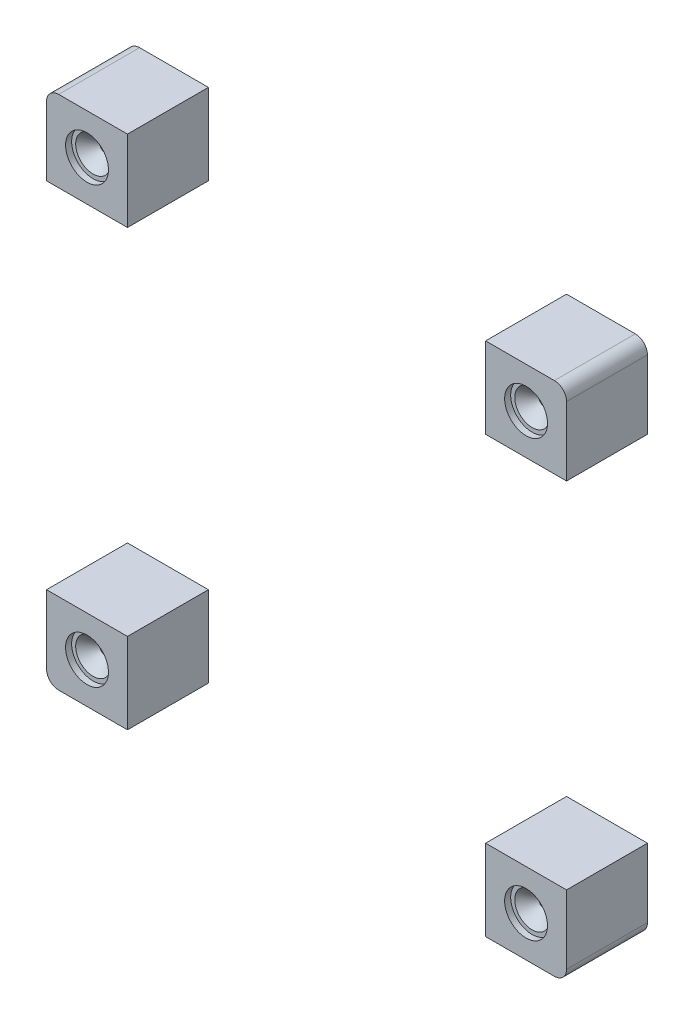
from build123d import *

# Parameters (mm, degrees)
EXTRUDE_1_DEPTH     = 20
EXTRUDE_1_2_DEPTH   = 20
EXTRUDE_1_3_DEPTH   = 20
EXTRUDE_1_4_DEPTH   = 20
SKETCH_2_R          = 1.3
CUT_EXTRUDE_1_DEPTH = 21
SKETCH_3_R          = 5.3
CUT_EXTRUDE_2_DEPTH = 1.5
CHAMFER_1_SIZE      = 3
CHAMFER_2_SIZE      = 3
CHAMFER_3_SIZE      = 3
CHAMFER_4_SIZE      = 3


with BuildPart() as part:
    # Эскиз1 → Бобышка-Вытянуть1 (new body)
    with BuildSketch(Plane.XY):
        with BuildLine():
            Line((-44.25, -43.75), (-64.25, -43.75))
            Line((-64.25, -43.75), (-64.25, -60.75))
            ThreePointArc((-64.25, -60.75), (-63.371320344, -62.871320344), (-61.25, -63.75))
            Line((-61.25, -63.75), (-44.25, -63.75))
            Line((-44.25, -63.75), (-44.25, -43.75))
        make_face()
    extrude(amount=EXTRUDE_1_DEPTH)


with BuildPart() as body_2:
    # Эскиз1 → Extrude 1 2 (new body)
    with BuildSketch(Plane.XY):
        with BuildLine():
            Line((44.25, -43.75), (44.25, -63.75))
            Line((44.25, -63.75), (61.25, -63.75))
            ThreePointArc((61.25, -63.75), (63.371320344, -62.871320344), (64.25, -60.75))
            Line((64.25, -60.75), (64.25, -43.75))
            Line((64.25, -43.75), (44.25, -43.75))
        make_face()
    extrude(amount=EXTRUDE_1_2_DEPTH)


with BuildPart() as body_3:
    # Эскиз1 → Extrude 1 3 (new body)
    with BuildSketch(Plane.XY):
        with BuildLine():
            Line((44.25, 43.75), (44.25, 63.75))
            Line((44.25, 63.75), (61.25, 63.75))
            ThreePointArc((61.25, 63.75), (63.371320344, 62.871320344), (64.25, 60.75))
            Line((64.25, 60.75), (64.25, 43.75))
            Line((64.25, 43.75), (44.25, 43.75))
        make_face()
    extrude(amount=EXTRUDE_1_3_DEPTH)


with BuildPart() as body_4:
    # Эскиз1 → Extrude 1 4 (new body)
    with BuildSketch(Plane.XY):
        with BuildLine():
            Line((-64.25, 60.75), (-64.25, 43.75))
            Line((-64.25, 43.75), (-44.25, 43.75))
            Line((-44.25, 43.75), (-44.25, 63.75))
            Line((-44.25, 63.75), (-61.25, 63.75))
            ThreePointArc((-61.25, 63.75), (-63.371320344, 62.871320344), (-64.25, 60.75))
        make_face()
    extrude(amount=EXTRUDE_1_4_DEPTH)


with BuildPart() as cut_extrude_1_tool:
    # Эскиз2 → Вырез-Вытянуть1 (new body)
    with BuildSketch(Plane.XY.offset(20)):
        with Locations((54.25, 53.75)):
            Circle(SKETCH_2_R)
        with Locations((-54.25, 53.75)):
            Circle(SKETCH_2_R)
        with Locations((-54.25, -53.75)):
            Circle(SKETCH_2_R)
        with Locations((54.25, -53.75)):
            Circle(SKETCH_2_R)
    extrude(amount=-CUT_EXTRUDE_1_DEPTH)


with BuildPart() as part_1:
    add(part.part)

    # Вырез-Вытянуть1: cut by cut_extrude_1_tool
    add(cut_extrude_1_tool.part, mode=Mode.SUBTRACT)


with BuildPart() as body_2_1:
    add(body_2.part)

    # Вырез-Вытянуть1: cut by cut_extrude_1_tool
    add(cut_extrude_1_tool.part, mode=Mode.SUBTRACT)


with BuildPart() as body_3_1:
    add(body_3.part)

    # Вырез-Вытянуть1: cut by cut_extrude_1_tool
    add(cut_extrude_1_tool.part, mode=Mode.SUBTRACT)


with BuildPart() as body_4_1:
    add(body_4.part)

    # Вырез-Вытянуть1: cut by cut_extrude_1_tool
    add(cut_extrude_1_tool.part, mode=Mode.SUBTRACT)


with BuildPart() as cut_extrude_2_tool:
    # Эскиз3 → Вырез-Вытянуть2 (new body)
    with BuildSketch(Plane.XY.offset(20)):
        with Locations((-54.25, 53.75)):
            Circle(SKETCH_3_R)
        with Locations((54.25, 53.75)):
            Circle(SKETCH_3_R)
        with Locations((54.25, -53.75)):
            Circle(SKETCH_3_R)
        with Locations((-54.25, -53.75)):
            Circle(SKETCH_3_R)
    extrude(amount=-CUT_EXTRUDE_2_DEPTH)


with BuildPart() as part_2:
    add(part_1.part)

    # Вырез-Вытянуть2: cut by cut_extrude_2_tool
    add(cut_extrude_2_tool.part, mode=Mode.SUBTRACT)

    # Фаска2
    chamfer_2_edges = [part_2.edges().sort_by_distance(p)[0] for p in [
        (-55.55, -53.75, 18.5),
    ]]
    chamfer(chamfer_2_edges, length=CHAMFER_2_SIZE)


with BuildPart() as body_2_2:
    add(body_2_1.part)

    # Вырез-Вытянуть2: cut by cut_extrude_2_tool
    add(cut_extrude_2_tool.part, mode=Mode.SUBTRACT)

    # Фаска4
    chamfer_4_edges = [body_2_2.edges().sort_by_distance(p)[0] for p in [
        (52.95, -53.75, 18.5),
    ]]
    chamfer(chamfer_4_edges, length=CHAMFER_4_SIZE)


with BuildPart() as body_3_2:
    add(body_3_1.part)

    # Вырез-Вытянуть2: cut by cut_extrude_2_tool
    add(cut_extrude_2_tool.part, mode=Mode.SUBTRACT)

    # Фаска3
    chamfer_3_edges = [body_3_2.edges().sort_by_distance(p)[0] for p in [
        (52.95, 53.75, 18.5),
    ]]
    chamfer(chamfer_3_edges, length=CHAMFER_3_SIZE)


with BuildPart() as body_4_2:
    add(body_4_1.part)

    # Вырез-Вытянуть2: cut by cut_extrude_2_tool
    add(cut_extrude_2_tool.part, mode=Mode.SUBTRACT)

    # Фаска1
    chamfer_1_edges = [body_4_2.edges().sort_by_distance(p)[0] for p in [
        (-55.55, 53.75, 18.5),
    ]]
    chamfer(chamfer_1_edges, length=CHAMFER_1_SIZE)


solid = Compound([part_2.part, body_2_2.part, body_3_2.part, body_4_2.part])
